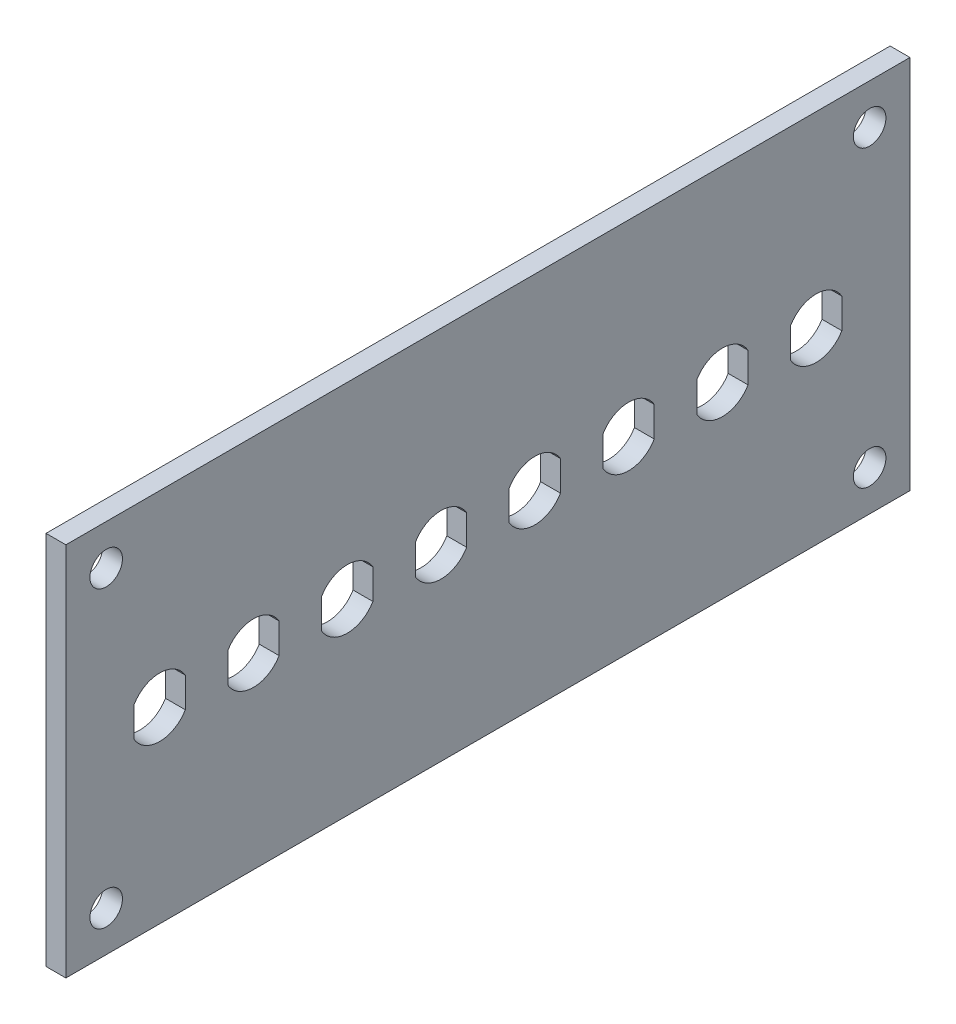
from build123d import *

# Parameters (mm, degrees)
BOSS_EXTRUDE1_DEPTH      = 1.5875
BOSS_EXTRUDE1_DEPTH_BACK = 1.5875
SKETCH1_W                = 135
SKETCH1_H                = 60
CUT_EXTRUDE1_DEPTH       = 74.883490417
CUT_EXTRUDE1_DEPTH_BACK  = 74.883490417
SKETCH2_R                = 2.6
CUT_EXTRUDE2_DEPTH       = 74.883490417
LPATTERN1_COUNT          = 8
LPATTERN1_PITCH          = 15


with BuildPart() as part:
    # Sketch1 → Boss-Extrude1 (new, two sides: drawn at the far end of the back side and taken through both)
    with BuildSketch(Plane(origin=(0, 0, 0), x_dir=(0, 0, -1), z_dir=(1, 0, 0)).offset(-BOSS_EXTRUDE1_DEPTH_BACK)):
        Rectangle(SKETCH1_W, SKETCH1_H)
    extrude(amount=BOSS_EXTRUDE1_DEPTH + BOSS_EXTRUDE1_DEPTH_BACK)

    # Sketch2 → Cut-Extrude1 (cut, two sides: drawn at the far end of the back side and taken through both)
    with BuildSketch(Plane(origin=(0, 0, 0), x_dir=(0, 0, -1), z_dir=(1, 0, 0)).offset(-CUT_EXTRUDE1_DEPTH_BACK)):
        with Locations((-61.05, 23.55)):
            Circle(SKETCH2_R)
        with Locations((61.05, 23.55)):
            Circle(SKETCH2_R)
        with Locations((61.05, -23.55)):
            Circle(SKETCH2_R)
        with Locations((-61.05, -23.55)):
            Circle(SKETCH2_R)
    extrude(amount=CUT_EXTRUDE1_DEPTH + CUT_EXTRUDE1_DEPTH_BACK, mode=Mode.SUBTRACT)

    # Sketch3 → Cut-Extrude2 (cut, symmetric)
    with BuildSketch(Plane(origin=(0, 0, 0), x_dir=(0, 0, -1), z_dir=(1, 0, 0))):
        with BuildLine():
            Line((-56.6, -2.398436991), (-56.6, 2.398436991))
            ThreePointArc((-56.6, 2.398436991), (-52.5, 4.75), (-48.4, 2.398436991))
            Line((-48.4, 2.398436991), (-48.4, -2.398436991))
            ThreePointArc((-48.4, -2.398436991), (-52.5, -4.75), (-56.6, -2.398436991))
        make_face()
    cut_extrude2 = extrude(amount=CUT_EXTRUDE2_DEPTH, both=True, mode=Mode.SUBTRACT)

    # LPattern1: Cut-Extrude2 ×8
    with Locations(*[(0, 0, -i * LPATTERN1_PITCH) for i in range(1, LPATTERN1_COUNT)]):
        add(cut_extrude2, mode=Mode.SUBTRACT)


solid = part.part
